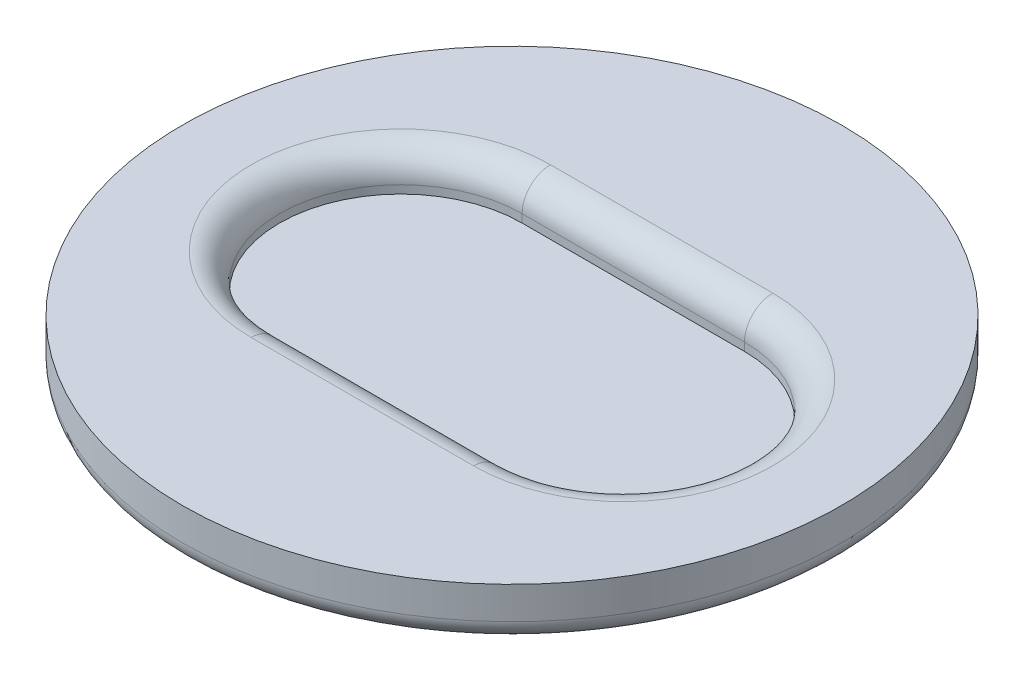
from build123d import *

# Parameters (mm, degrees)
SKETCH1_R           = 8.15
BOSS_EXTRUDE1_DEPTH = 1.3
BOSS_EXTRUDE2_DEPTH = 0.4
FILLET3_R           = 0.7
FILLET4_R           = 0.5


with BuildPart() as part:
    # Sketch1 → Boss-Extrude1 (new body)
    with BuildSketch(Plane(origin=(0, 0, 0), x_dir=(1, 0, 0), z_dir=(0, 1, 0))):
        Circle(SKETCH1_R)
        with BuildLine():
            ThreePointArc((-2.75, -3), (-5.75, 0), (-2.75, 3))
            Line((-2.75, 3), (2.75, 3))
            ThreePointArc((2.75, 3), (4.871320344, 2.121320344), (5.75, 0))
            ThreePointArc((5.75, 0), (4.871320344, -2.121320344), (2.75, -3))
            Line((2.75, -3), (-2.75, -3))
        make_face(mode=Mode.SUBTRACT)
    extrude(amount=BOSS_EXTRUDE1_DEPTH)

    # Sketch1<3> → Boss-Extrude2 (add)
    with BuildSketch(Plane(origin=(0, 0, 0), x_dir=(1, 0, 0), z_dir=(0, 1, 0))):
        with BuildLine():
            ThreePointArc((-2.75, 3), (-5.75, 0), (-2.75, -3))
            Line((-2.75, -3), (2.75, -3))
            ThreePointArc((2.75, -3), (5.75, 0), (2.75, 3))
            Line((2.75, 3), (-2.75, 3))
        make_face()
    extrude(amount=BOSS_EXTRUDE2_DEPTH)

    # Fillet3
    fillet3_edges = [part.edges().sort_by_distance(p)[0] for p in [
        (5.75, 1.3, 0),
        (0, 1.3, 3),
        (-5.75, 1.3, 0),
        (0, 1.3, -3),
    ]]
    fillet(fillet3_edges, radius=FILLET3_R)

    # Fillet4
    fillet4_edges = [part.edges().sort_by_distance(p)[0] for p in [
        (-8.15, 0, 0),
    ]]
    fillet(fillet4_edges, radius=FILLET4_R)


solid = part.part
